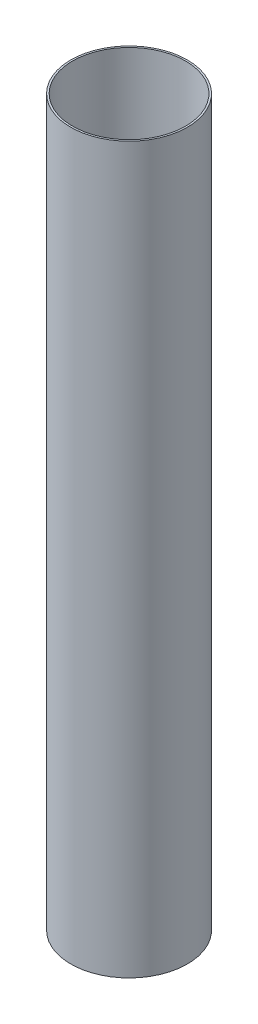
from build123d import *

# Parameters (mm, degrees)
SKETCH1_R           = 51.1048
SKETCH1_R_2         = 49.53
BOSS_EXTRUDE1_DEPTH = 635


with BuildPart() as part:
    # Sketch1 → Boss-Extrude1 (new body)
    with BuildSketch(Plane(origin=(0, 0, 0), x_dir=(1, 0, 0), z_dir=(0, 1, 0))):
        with Locations(Location((0, 0, 0), (0, 0, 90))):
            Circle(SKETCH1_R)
        with Locations(Location((0, 0, 0), (0, 0, 90))):
            Circle(SKETCH1_R_2, mode=Mode.SUBTRACT)
    extrude(amount=BOSS_EXTRUDE1_DEPTH)


solid = part.part
